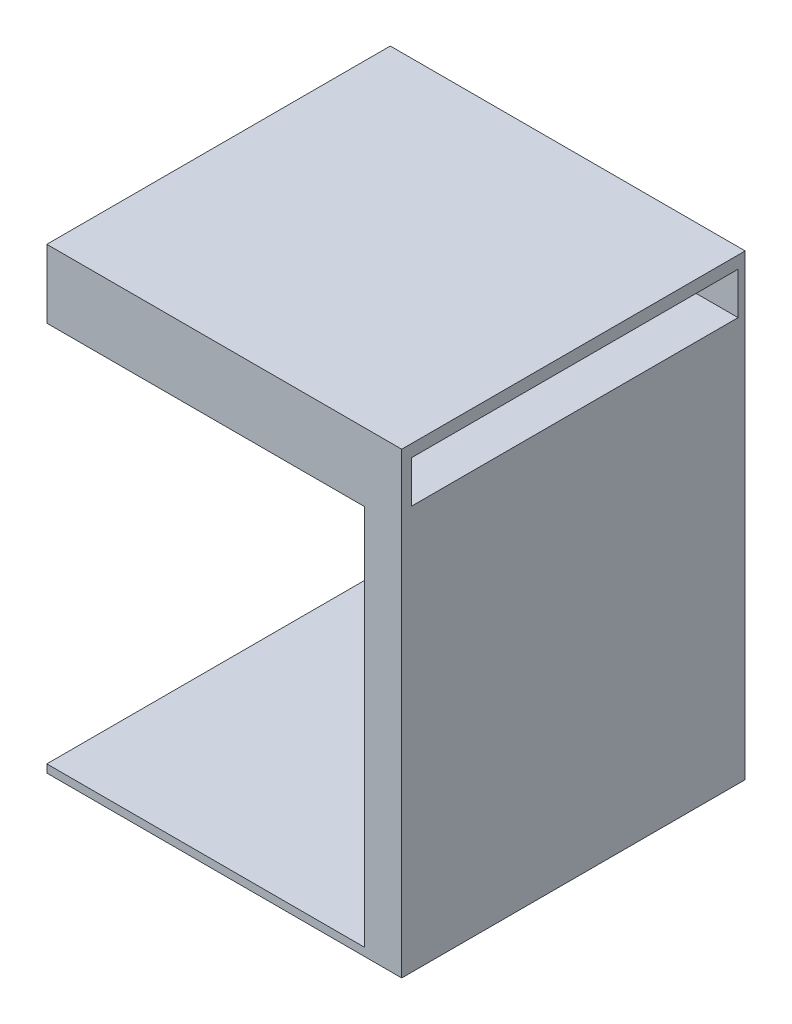
from build123d import *

# Parameters (mm, degrees)
SKETCH1_W           = 93
SKETCH1_H           = 90
BOSS_EXTRUDE2_DEPTH = 120
SKETCH4_W           = 83.188465172
SKETCH4_H           = 100
CUT_EXTRUDE2_DEPTH  = 86
SKETCH6_W           = 85.554409806
SKETCH6_H           = 11
CUT_EXTRUDE4_DEPTH  = 86
CUT_EXTRUDE5_START  = -10
SKETCH8_W           = 74.401519334
SKETCH8_H           = 6.478481014
CUT_EXTRUDE5_DEPTH  = 50


with BuildPart() as part:
    # Sketch1 → Boss-Extrude2 (new body)
    with BuildSketch(Plane(origin=(0, 0, 0), x_dir=(1, 0, 0), z_dir=(0, 1, 0))):
        Rectangle(SKETCH1_W, SKETCH1_H)
    extrude(amount=BOSS_EXTRUDE2_DEPTH)

    # Sketch4 → Cut-Extrude2 (cut)
    with BuildSketch(Plane.XY.offset(45)):
        with Locations((-4.905767414, 52.095291963)):
            Rectangle(SKETCH4_W, SKETCH4_H)
    extrude(amount=-CUT_EXTRUDE2_DEPTH, mode=Mode.SUBTRACT)

    # Sketch6 → Cut-Extrude4 (cut)
    with BuildSketch(Plane(origin=(46.5, 0, 0), x_dir=(0, 0, -1), z_dir=(1, 0, 0))):
        with Locations((0.366871397, 111.285550359)):
            Rectangle(SKETCH6_W, SKETCH6_H)
    extrude(amount=-CUT_EXTRUDE4_DEPTH, mode=Mode.SUBTRACT)

    # Sketch8 → Cut-Extrude5 (cut)
    with BuildSketch(Plane.ZY.offset(46.5).offset(CUT_EXTRUDE5_START)):
        with Locations((1.540859868, 105.33453247)):
            Rectangle(SKETCH8_W, SKETCH8_H)
    extrude(amount=-CUT_EXTRUDE5_DEPTH, mode=Mode.SUBTRACT)


solid = part.part
